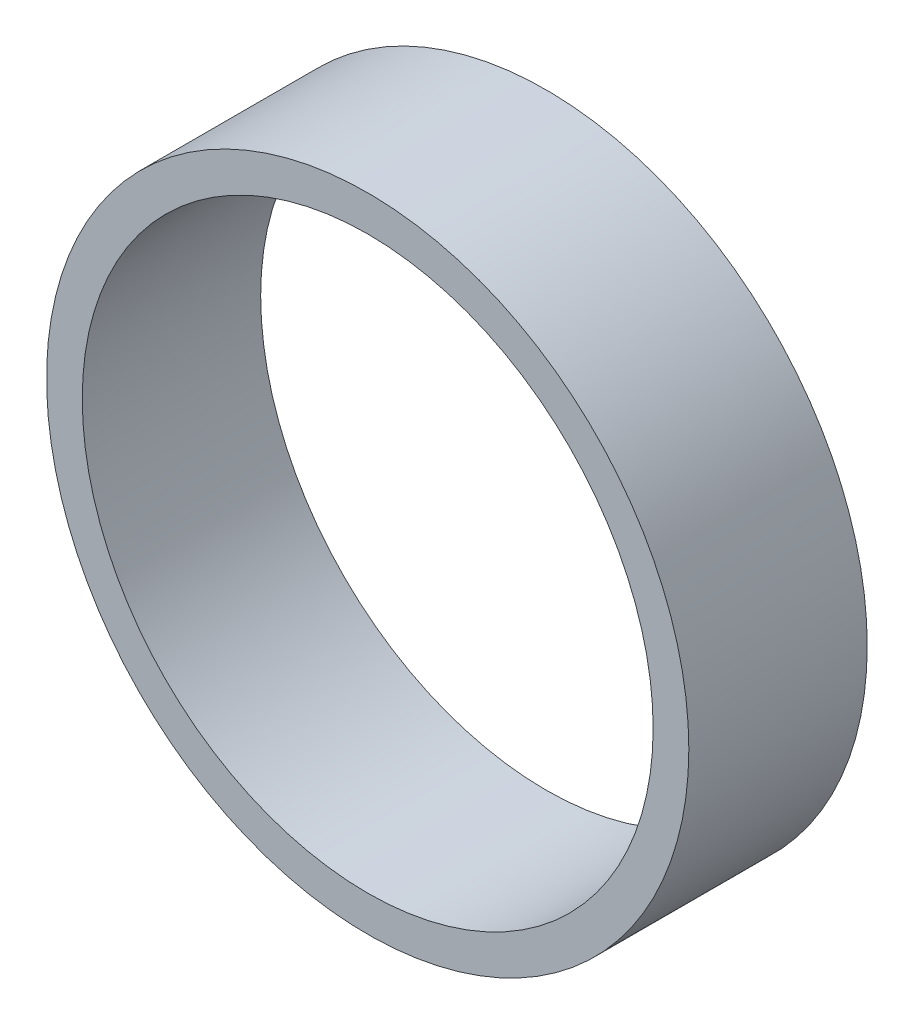
from build123d import *

# Parameters (mm, degrees)
SKETCH_1_R      = 1.8
SKETCH_1_R_2    = 1.6
EXTRUDE_1_DEPTH = 1


with BuildPart() as part:
    # 草图1 → 凸台-拉伸1 (new body)
    with BuildSketch(Plane.XY):
        Circle(SKETCH_1_R)
        Circle(SKETCH_1_R_2, mode=Mode.SUBTRACT)
    extrude(amount=EXTRUDE_1_DEPTH)


solid = part.part
